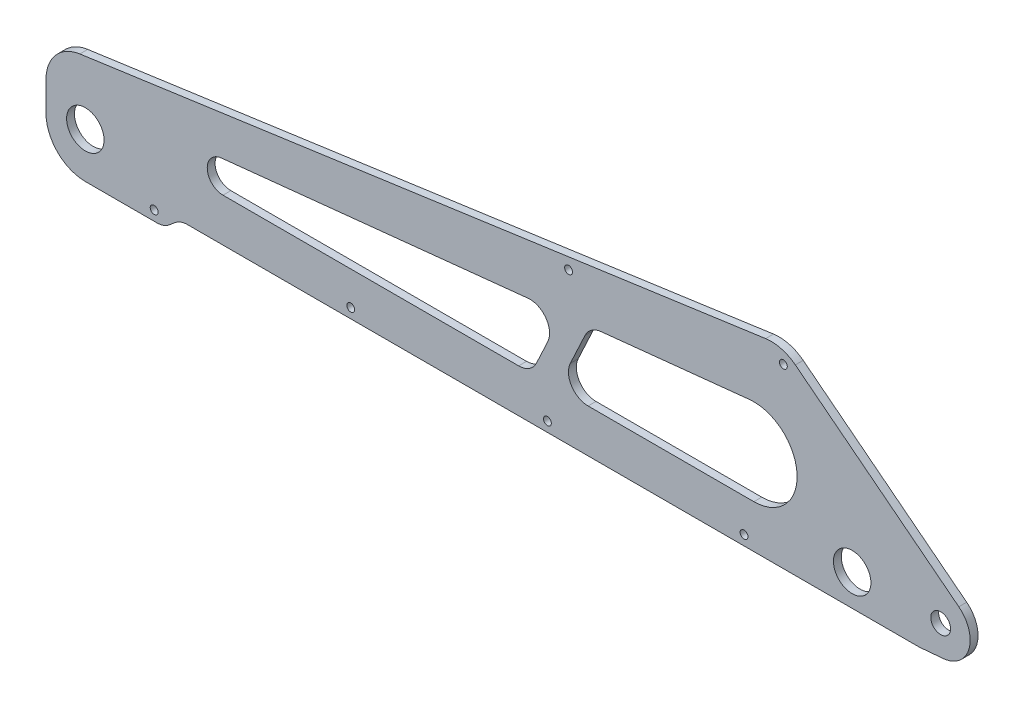
from build123d import *

# Parameters (mm, degrees)
SKETCH_1_R      = 5.03
SKETCH_1_R_2    = 2
SKETCH_1_R_3    = 9.53
EXTRUDE_1_DEPTH = 4


with BuildPart() as part:
    # 草图1 → 凸台-拉伸1 (new body)
    with BuildSketch(Plane.XY):
        with BuildLine():
            Line((-392.783462019, 31.805361375), (-44.003979129, 80.823121027))
            ThreePointArc((-44.003979129, 80.823121027), (-36.044136208, 80.336276178), (-28.907287603, 76.777974725))
            Line((-28.907287603, 76.777974725), (54.23492213, 11.820161304))
            ThreePointArc((54.23492213, 11.820161304), (59.382296023, -4.260230171), (46.307336141, -14.942920471))
            Line((46.307336141, -14.942920471), (34.224861841, -16))
            Line((34.224861841, -16), (-338.018022509, -16))
            ThreePointArc((-338.018022509, -16), (-341.438223942, -16.603073792), (-344.445898606, -18.339555569))
            Line((-344.445898606, -18.339555569), (-347.211826246, -20.660444431))
            ThreePointArc((-347.211826246, -20.660444431), (-350.219500909, -22.396926208), (-353.639702343, -23))
            Line((-353.639702343, -23), (-390, -23))
            ThreePointArc((-390, -23), (-404.142135624, -17.142135624), (-410, -3))
            Line((-410, -3), (-410, 12))
            ThreePointArc((-410, 12), (-405.094191604, 25.12118058), (-392.783462019, 31.805361375))
        make_face()
        with Locations((45, 0)):
            Circle(SKETCH_1_R, mode=Mode.SUBTRACT)
        with Locations((-55, -11)):
            Circle(SKETCH_1_R_2, mode=Mode.SUBTRACT)
        with Locations((-144.229116997, 61)):
            Circle(SKETCH_1_R_2, mode=Mode.SUBTRACT)
        Circle(SKETCH_1_R_3, mode=Mode.SUBTRACT)
        with Locations((-255, -11)):
            Circle(SKETCH_1_R_2, mode=Mode.SUBTRACT)
        with Locations((-390, 0)):
            Circle(SKETCH_1_R_3, mode=Mode.SUBTRACT)
        with Locations((-35, 74)):
            Circle(SKETCH_1_R_2, mode=Mode.SUBTRACT)
        with Locations((-355, -18)):
            Circle(SKETCH_1_R_2, mode=Mode.SUBTRACT)
        with Locations((-155, -11)):
            Circle(SKETCH_1_R_2, mode=Mode.SUBTRACT)
        with BuildLine():
            Line((-134.303144229, 6), (-50, 6))
            ThreePointArc((-50, 6), (-28.029515257, 29.13921032), (-52.275363905, 49.882018168))
            Line((-52.275363905, 49.882018168), (-127.840019308, 42.024557851))
            ThreePointArc((-127.840019308, 42.024557851), (-132.608278027, 40.222559427), (-135.868840858, 36.304368574))
            Line((-135.868840858, 36.304368574), (-143.366222099, 20.226182617))
            ThreePointArc((-143.366222099, 20.226182617), (-142.737058687, 10.627003917), (-134.303144229, 6))
        make_face(mode=Mode.SUBTRACT)
        with BuildLine():
            Line((-320, 6), (-169.611237636, 6))
            ThreePointArc((-169.611237636, 6), (-164.238241552, 7.566085542), (-160.548159765, 11.773817383))
            Line((-160.548159765, 11.773817383), (-154.850047639, 23.993458271))
            ThreePointArc((-154.850047639, 23.993458271), (-155.76875204, 34.022155928), (-164.94738183, 38.166012783))
            Line((-164.94738183, 38.166012783), (-320.827405056, 21.957097516))
            ThreePointArc((-320.827405056, 21.957097516), (-327.989267179, 13.585741702), (-320, 6))
        make_face(mode=Mode.SUBTRACT)
    extrude(amount=EXTRUDE_1_DEPTH)


solid = part.part
